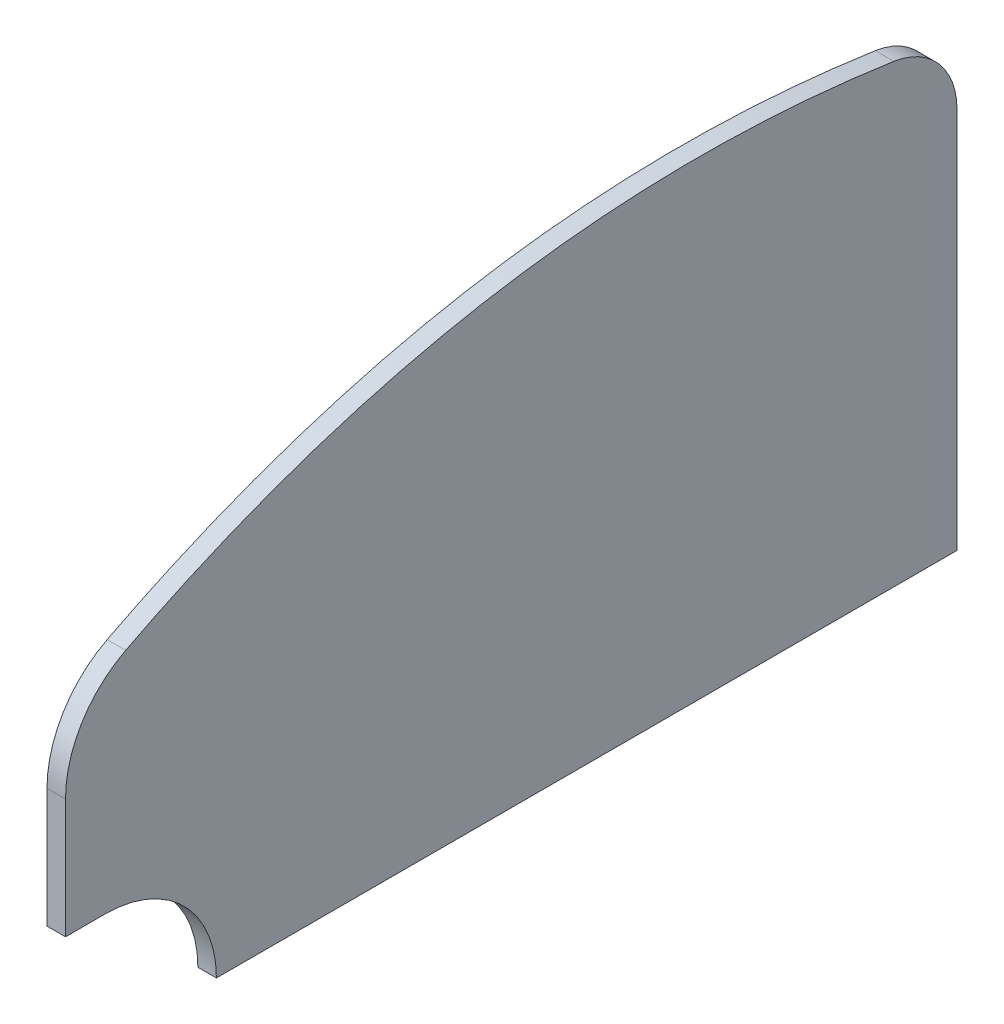
from build123d import *

# Parameters (mm, degrees)
BOSS_EXTRUDE1_DEPTH = 12.7
FILLET1_R           = 76.2
FILLET2_R           = 50.8


with BuildPart() as part:
    # Sketch1 → Boss-Extrude1 (new body)
    with BuildSketch(Plane(origin=(0, 0, 0), x_dir=(0, 0, -1), z_dir=(1, 0, 0))):
        with BuildLine():
            Line((-59.310344828, 100.965517241), (-59.310344828, -26.034482759))
            Line((-59.310344828, -26.034482759), (-31.989836752, -26.034482759))
            ThreePointArc((-31.989836752, -26.034482759), (21.891699975, -48.352946032), (44.210163248, -102.234482759))
            Line((44.210163248, -102.234482759), (552.210163248, -102.234482759))
            Line((552.210163248, -102.234482759), (552.210163248, 202.565517241))
            add(Edge.make_bspline(
                [(552.210163248, 202.565517241), (225.141214241, 265.702079645), (-59.310344828, 100.965517241)],
                knots=[0, 0, 0, 1, 1, 1], degree=2))
        make_face()
    extrude(amount=BOSS_EXTRUDE1_DEPTH)

    # Fillet1
    fillet1_edges = [part.edges().sort_by_distance(p)[0] for p in [
        (6.35, 100.965517241, 59.310344828),
    ]]
    fillet(fillet1_edges, radius=FILLET1_R)

    # Fillet2
    fillet2_edges = [part.edges().sort_by_distance(p)[0] for p in [
        (6.35, 202.565517241, -552.210163248),
    ]]
    fillet(fillet2_edges, radius=FILLET2_R)


solid = part.part
